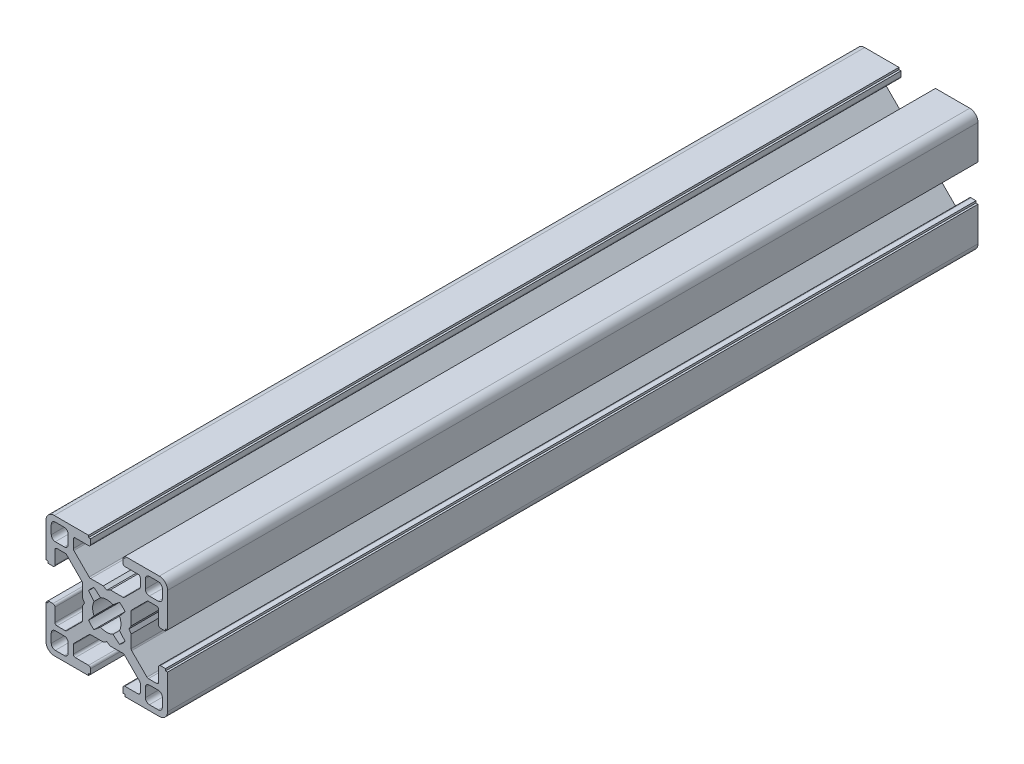
from build123d import *

# Parameters (mm, degrees)
BOSS_EXTRUDE1_DEPTH = 100
CIRPATTERN1_COUNT   = 4


with BuildPart() as part:
    # Sketch3 → Boss-Extrude1 (new, symmetric)
    with BuildSketch(Plane.XY):
        with BuildLine():
            Line((-4.503841895, 3.156803476), (-3.14772708, 1.530298739))
            ThreePointArc((-3.14772708, 1.530298739), (-3.410794979, 0.785160882), (-3.5, 0))
            Line((-3.5, 0), (-5.5, 0))
            Line((-5.5, 0), (-6, 0.866025404))
            Line((-6, 0.866025404), (-6, 3.996841995))
            ThreePointArc((-6, 3.996841995), (-6.038060234, 4.188183711), (-6.146446609, 4.350395385))
            Line((-6.146446609, 4.350395385), (-9.917104615, 8.121053391))
            ThreePointArc((-9.917104615, 8.121053391), (-10.079316289, 8.229439766), (-10.270658005, 8.2675))
            Line((-10.270658005, 8.2675), (-12.29, 8.2675))
            ThreePointArc((-12.29, 8.2675), (-12.643553391, 8.121053391), (-12.79, 7.7675))
            Line((-12.79, 7.7675), (-12.79, 4.5))
            ThreePointArc((-12.79, 4.5), (-12.936446609, 4.146446609), (-13.29, 4))
            Line((-13.29, 4), (-14.5, 4))
            Line((-14.5, 4), (-14.5, 4.5))
            Line((-14.5, 4.5), (-15, 4.5))
            Line((-15, 4.5), (-15, 12.968))
            ThreePointArc((-15, 12.968), (-14.404840979, 14.404840979), (-12.968, 15))
            Line((-12.968, 15), (-4.5, 15))
            Line((-4.5, 15), (-4.5, 14.5))
            Line((-4.5, 14.5), (-4, 14.5))
            Line((-4, 14.5), (-4, 13.29))
            ThreePointArc((-4, 13.29), (-4.146446609, 12.936446609), (-4.5, 12.79))
            Line((-4.5, 12.79), (-7.7675, 12.79))
            ThreePointArc((-7.7675, 12.79), (-8.121053391, 12.643553391), (-8.2675, 12.29))
            Line((-8.2675, 12.29), (-8.2675, 10.270658005))
            ThreePointArc((-8.2675, 10.270658005), (-8.229439766, 10.079316289), (-8.121053391, 9.917104615))
            Line((-8.121053391, 9.917104615), (-4.350395385, 6.146446609))
            ThreePointArc((-4.350395385, 6.146446609), (-4.188183711, 6.038060234), (-3.996841995, 6))
            Line((-3.996841995, 6), (-0.866025404, 6))
            Line((-0.866025404, 6), (0, 5.5))
            Line((0, 5.5), (0, 3.5))
            ThreePointArc((0, 3.5), (-0.785160882, 3.410794979), (-1.530298739, 3.14772708))
            Line((-1.530298739, 3.14772708), (-3.156803476, 4.503841895))
            ThreePointArc((-3.156803476, 4.503841895), (-3.889087297, 3.889087297), (-4.503841895, 3.156803476))
        make_face()
        with BuildLine():
            Line((-12.705, 9.5135), (-10.5135, 9.5135))
            ThreePointArc((-10.5135, 9.5135), (-9.806393219, 9.806393219), (-9.5135, 10.5135))
            Line((-9.5135, 10.5135), (-9.5135, 12.705))
            ThreePointArc((-9.5135, 12.705), (-9.806393219, 13.412106781), (-10.5135, 13.705))
            Line((-10.5135, 13.705), (-12.705, 13.705))
            ThreePointArc((-12.705, 13.705), (-13.412106781, 13.412106781), (-13.705, 12.705))
            Line((-13.705, 12.705), (-13.705, 10.5135))
            ThreePointArc((-13.705, 10.5135), (-13.412106781, 9.806393219), (-12.705, 9.5135))
        make_face(mode=Mode.SUBTRACT)
    boss_extrude1 = extrude(amount=BOSS_EXTRUDE1_DEPTH, both=True)

    # CirPattern1: Boss-Extrude1 ×4 about axis
    cirpattern1_axis = Axis((0, 0, 0), (0, 0, 1))
    for i in range(1, CIRPATTERN1_COUNT):
        add(boss_extrude1.rotate(cirpattern1_axis, i * 360 / CIRPATTERN1_COUNT))


solid = part.part
